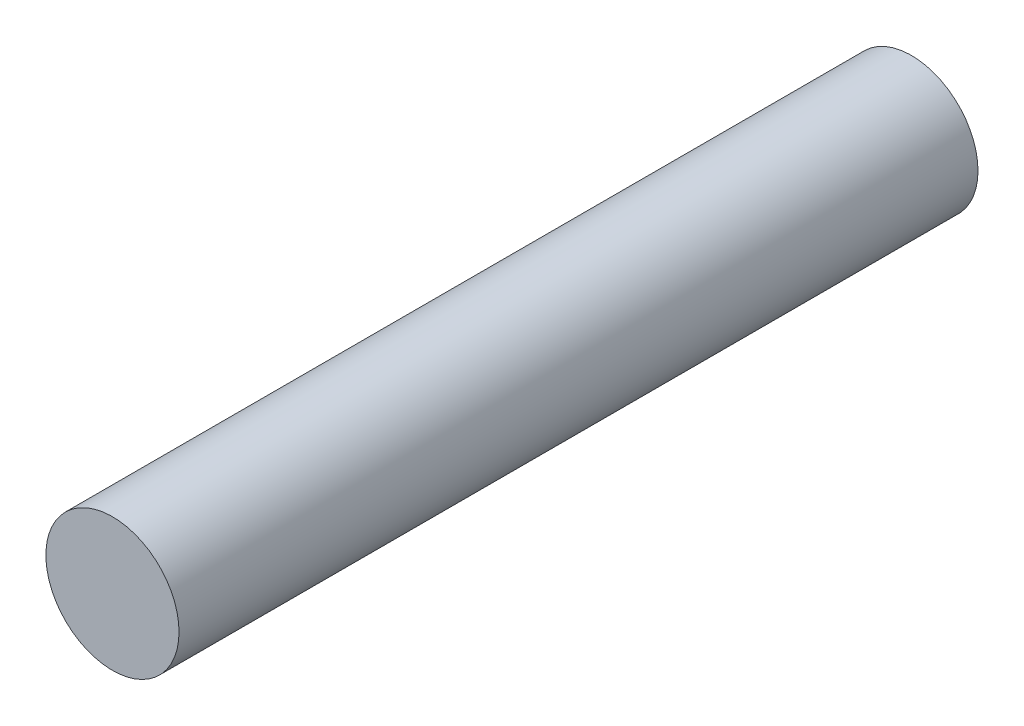
from build123d import *

# Parameters (mm, degrees)
SKETCH_1_R      = 12.5
EXTRUDE_1_DEPTH = 150


with BuildPart() as part:
    # Эскиз1 → Бобышка-Вытянуть1 (new body)
    with BuildSketch(Plane.XY):
        Circle(SKETCH_1_R)
    extrude(amount=EXTRUDE_1_DEPTH)


solid = part.part
